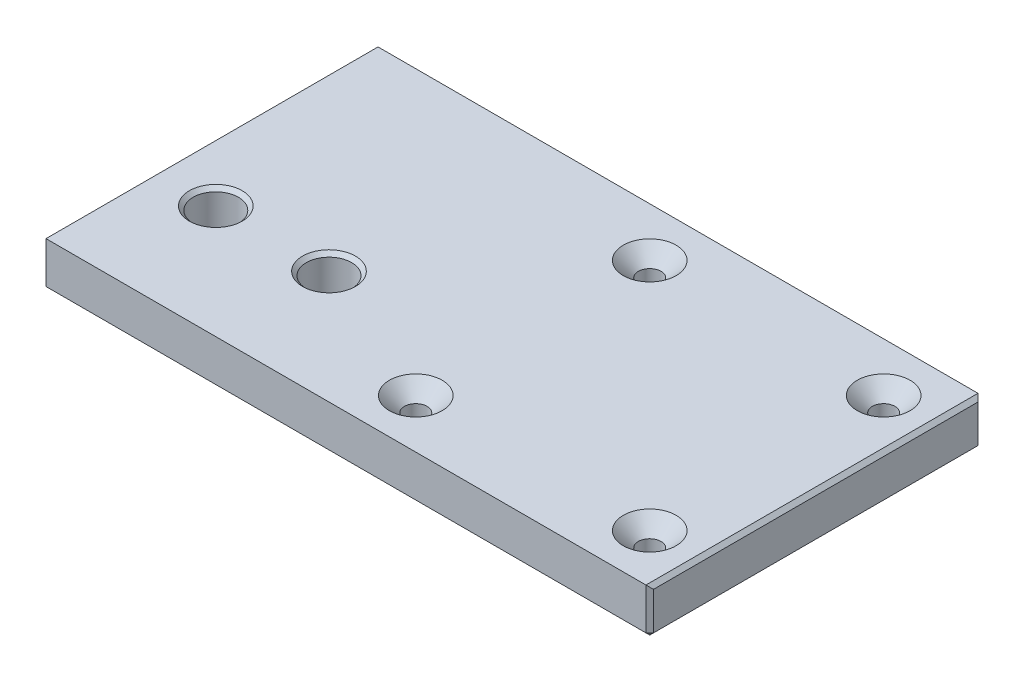
from build123d import *

# Parameters (mm, degrees)
CROQUIS1_W              = 80.5
CROQUIS1_H              = 44
CROQUIS1_R              = 1.5
CROQUIS1_R_2            = 3
SALIENTE_EXTRUIR1_DEPTH = 6
CHAFL_N1_SIZE           = 0.5
CHAFL_N2_SIZE           = 2


with BuildPart() as part:
    # Croquis1 → Saliente-Extruir1 (new body)
    with BuildSketch(Plane(origin=(0, 0, 0), x_dir=(1, 0, 0), z_dir=(0, 1, 0))):
        with Locations((7.521686308, -1.221461187)):
            Rectangle(CROQUIS1_W, CROQUIS1_H)
        with Locations(Location((10.271686308, 14.278538813, 0), (0, 0, 270))):
            Circle(CROQUIS1_R, mode=Mode.SUBTRACT)
        with Locations(Location((41.271686308, 14.278538813, 0), (0, 0, 270))):
            Circle(CROQUIS1_R, mode=Mode.SUBTRACT)
        with Locations(Location((10.271686308, -16.721461187, 0), (0, 0, 270))):
            Circle(CROQUIS1_R, mode=Mode.SUBTRACT)
        with Locations(Location((41.271686308, -16.721461187, 0), (0, 0, 270))):
            Circle(CROQUIS1_R, mode=Mode.SUBTRACT)
        with Locations(Location((-24.728313692, -8.221461187, 0), (0, 0, 270))):
            Circle(CROQUIS1_R_2, mode=Mode.SUBTRACT)
        with Locations(Location((-9.728313692, -8.221461187, 0), (0, 0, 270))):
            Circle(CROQUIS1_R_2, mode=Mode.SUBTRACT)
    extrude(amount=SALIENTE_EXTRUIR1_DEPTH)

    # Chaflán1
    chafl_n1_edges = [part.edges().sort_by_distance(p)[0] for p in [
        (47.771686308, 6, 1.221461187),
        (10.271686308, 0, -15.778538813),
        (41.271686308, 0, -15.778538813),
        (10.271686308, 0, 15.221461187),
        (41.271686308, 0, 15.221461187),
        (-24.728313692, 0, 5.221461187),
        (-24.728313692, 6, 5.221461187),
        (-9.728313692, 0, 5.221461187),
        (-9.728313692, 6, 5.221461187),
        (-32.728313692, 6, 1.221461187),
        (7.521686308, 0, -20.778538813),
        (47.771686308, 0, 1.221461187),
        (7.521686308, 0, 23.221461187),
        (-32.728313692, 0, 1.221461187),
        (-32.728313692, 3, -20.778538813),
        (47.771686308, 3, -20.778538813),
        (47.771686308, 3, 23.221461187),
        (-32.728313692, 3, 23.221461187),
    ]]
    chamfer(chafl_n1_edges, length=CHAFL_N1_SIZE)

    # Chaflán2
    chafl_n2_edges = [part.edges().sort_by_distance(p)[0] for p in [
        (10.271686308, 6, -15.778538813),
        (41.271686308, 6, -15.778538813),
        (10.271686308, 6, 15.221461187),
        (41.271686308, 6, 15.221461187),
    ]]
    chamfer(chafl_n2_edges, length=CHAFL_N2_SIZE)


solid = part.part
